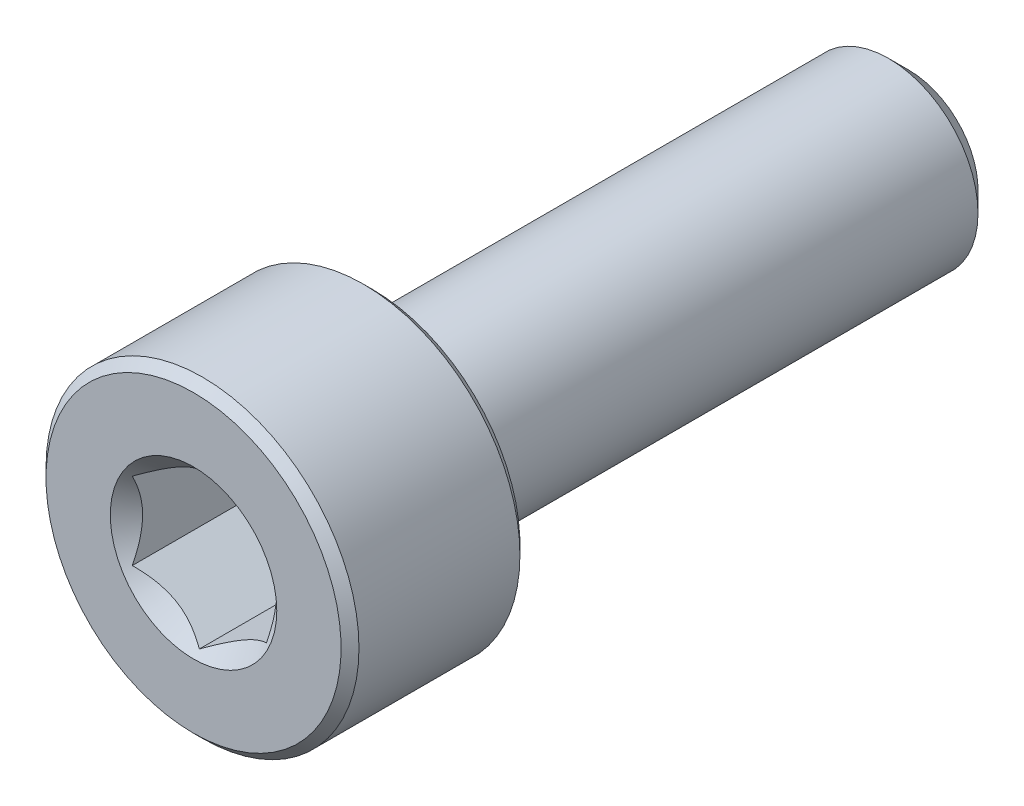
from build123d import *

# Parameters (mm, degrees)
CUT_EXTRUDE1_DEPTH = 3


with BuildPart() as part:
    # Sketch2 → Revolve1 (revolve)
    with BuildSketch(Plane(origin=(0, 0, 0), x_dir=(0, 0, -1), z_dir=(1, 0, 0))):
        with BuildLine():
            Line((-8, 0), (-8, 3.3))
            Line((-8, 3.3), (-7.8, 3.5))
            Line((-7.8, 3.5), (-4.2, 3.5))
            Line((-4.2, 3.5), (-4, 3.3))
            Line((-4, 3.3), (-4, 2.2))
            ThreePointArc((-4, 2.2), (-3.941421356, 2.058578644), (-3.8, 2))
            Line((-3.8, 2), (7.545336663, 2))
            Line((7.545336663, 2), (8, 1.545336663))
            Line((8, 1.545336663), (8, 0))
            Line((8, 0), (-8, 0))
        make_face()
    revolve(axis=Axis((0, 0, -8), (0, 0, 1)))

    # Sketch3 → Cut-Extrude1 (cut)
    with BuildSketch(Plane.XY.offset(8)):
        Polygon((1.5, -0.866025404), (1.5, 0.866025404), (0, 1.732050808), (-1.5, 0.866025404), (-1.5, -0.866025404), (0, -1.732050808), align=None)
    extrude(amount=-CUT_EXTRUDE1_DEPTH, mode=Mode.SUBTRACT)

    # Cut-Extrude2 cone 1 section (through the dimple's axis) → Cut-Extrude2 (revolve, cut)
    with BuildSketch(Plane(origin=(0, 0, 8), x_dir=(0, -1, 0), z_dir=(1, 0, 0))):
        Polygon((0, 0), (1.861954618, 0), (0, 1.861954618), align=None)
    revolve(axis=Axis((0, 0, 8), (0, 0, -1)), mode=Mode.SUBTRACT)


solid = part.part
